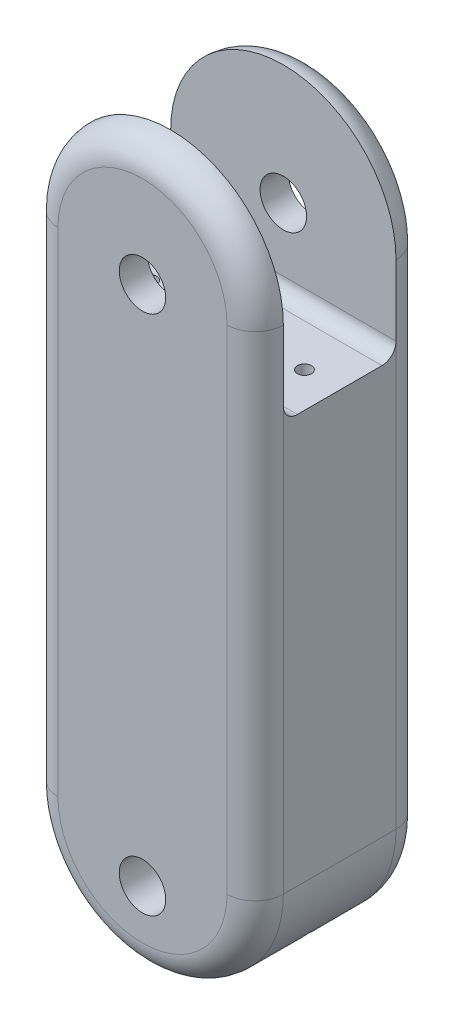
from build123d import *

# Parameters (mm, degrees)
BOSS_EXTRUDE1_DEPTH = 12
FILLET1_R           = 2
SKETCH3_W           = 8
SKETCH3_H           = 14
CUT_EXTRUDE1_DEPTH  = 33.407560846
FILLET5_R           = 1
SKETCH4_R           = 1.65
CUT_EXTRUDE2_DEPTH  = 30.295904151
SKETCH6_R           = 0.5
CUT_EXTRUDE3_DEPTH  = 54


with BuildPart() as part:
    # Sketch2 → Boss-Extrude1 (new body)
    with BuildSketch(Plane.XY):
        with BuildLine():
            Line((-8, -17.5), (-8, 17.5))
            ThreePointArc((-8, 17.5), (0, 25.5), (8, 17.5))
            Line((8, 17.5), (8, -17.5))
            ThreePointArc((8, -17.5), (0, -25.5), (-8, -17.5))
        make_face()
    extrude(amount=BOSS_EXTRUDE1_DEPTH)

    # Fillet1
    fillet1_edges = [part.edges().sort_by_distance(p)[0] for p in [
        (0, 25.5, 12),
        (-8, 0, 12),
        (0, -25.5, 12),
        (-8, 0, 0),
        (0, 25.5, 0),
        (8, 0, 0),
        (0, -25.5, 0),
        (8, 0, 12),
    ]]
    fillet(fillet1_edges, radius=FILLET1_R)

    # Sketch3 → Cut-Extrude1 (cut, through all)
    with BuildSketch(Plane(origin=(8, 0, 0), x_dir=(0, 0, -1), z_dir=(1, 0, 0))):
        with Locations((-6, 18.5)):
            Rectangle(SKETCH3_W, SKETCH3_H)
    extrude(amount=-CUT_EXTRUDE1_DEPTH, mode=Mode.SUBTRACT)

    # Fillet5
    fillet5_edges = [part.edges().sort_by_distance(p)[0] for p in [
        (0, 11.5, 10),
        (0, 11.5, 2),
    ]]
    fillet(fillet5_edges, radius=FILLET5_R)

    # Sketch4 → Cut-Extrude2 (cut, through all)
    with BuildSketch(Plane.XY.offset(12)):
        with Locations((0, 17)):
            Circle(SKETCH4_R)
        with Locations((0, -20)):
            Circle(SKETCH4_R)
    extrude(amount=-CUT_EXTRUDE2_DEPTH, mode=Mode.SUBTRACT)

    # Sketch6 → Cut-Extrude3 (cut, through all)
    with BuildSketch(Plane(origin=(0, -25.5, 0), x_dir=(-1, 0, 0), z_dir=(0, -1, 0))):
        with Locations(Location((-5.5, -6, 0), (0, 0, 90))):
            Circle(SKETCH6_R)
        with Locations(Location((5.5, -6, 0), (0, 0, 90))):
            Circle(SKETCH6_R)
    extrude(amount=-CUT_EXTRUDE3_DEPTH, mode=Mode.SUBTRACT)


solid = part.part
